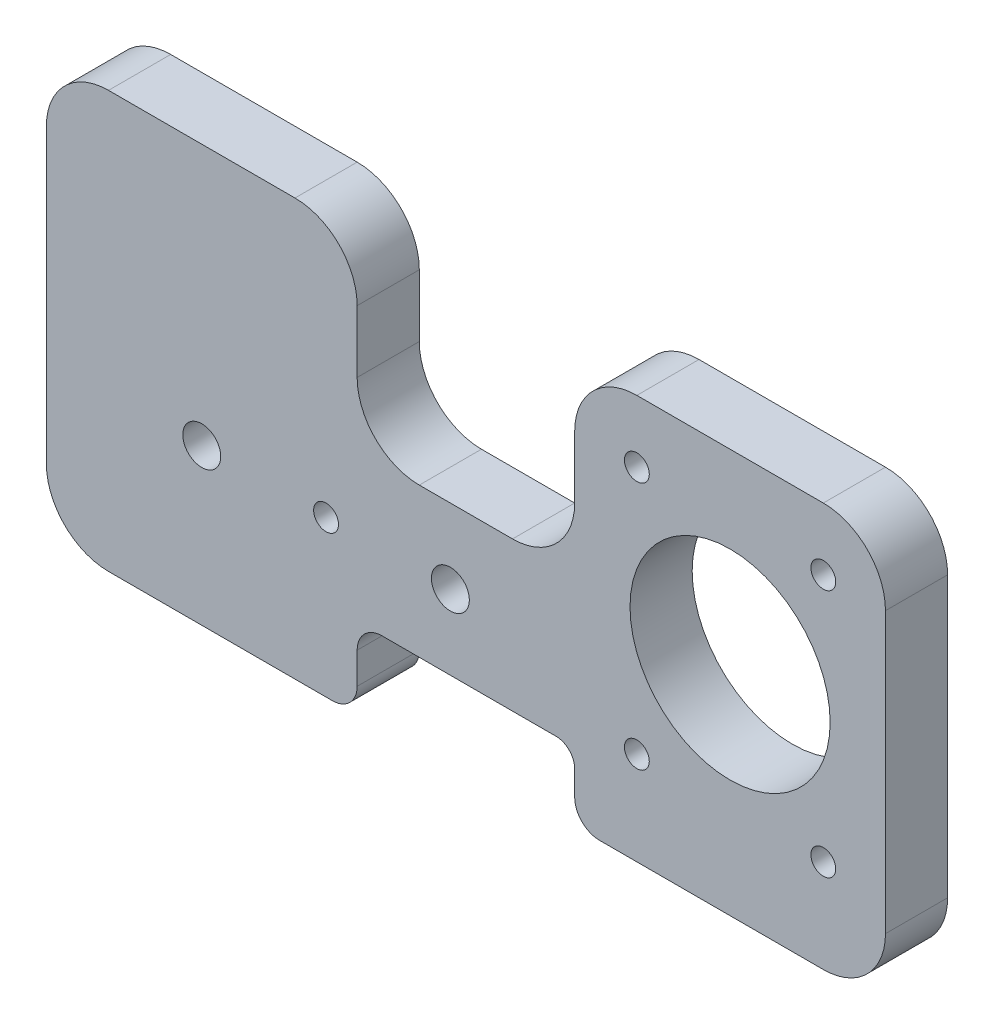
from build123d import *

# Parameters (mm, degrees)
MODEL_R             = 2
MODEL_R_2           = 3.05
MODEL_R_3           = 6.75
BOSS_EXTRUDE1_DEPTH = 10
SKETCH2_R           = 16.1
CUT_EXTRUDE1_DEPTH  = 10


with BuildPart() as part:
    # Model → Boss-Extrude1 (new body)
    with BuildSketch(Plane.XY):
        with BuildLine():
            Line((106.910569106, -1), (106.910569106, 3))
            ThreePointArc((106.910569106, 3), (106.031889449, 5.121320344), (103.910569106, 6))
            Line((103.910569106, 6), (75.910569106, 6))
            ThreePointArc((75.910569106, 6), (73.082141981, 4.828427125), (71.910569106, 2))
            Line((71.910569106, 2), (71.910569106, -3.03491552))
            ThreePointArc((71.910569106, -3.03491552), (70.73899623, -5.863342645), (67.910569106, -7.034915521))
            Line((67.910569106, -7.034915521), (31.910569106, -7.034915521))
            ThreePointArc((31.910569106, -7.034915521), (24.839501294, -4.105983332), (21.910569106, 2.96508448))
            Line((21.910569106, 2.96508448), (21.910569106, 50))
            ThreePointArc((21.910569106, 50), (24.839501294, 57.071067812), (31.910569106, 60))
            Line((31.910569106, 60), (61.910569106, 60))
            ThreePointArc((61.910569106, 60), (68.981636918, 57.071067812), (71.910569106, 50))
            Line((71.910569106, 50), (71.910569106, 40))
            ThreePointArc((71.910569106, 40), (74.839501294, 32.928932188), (81.910569106, 30))
            Line((81.910569106, 30), (96.910569106, 30))
            ThreePointArc((96.910569106, 30), (103.981636918, 32.928932188), (106.910569106, 40))
            Line((106.910569106, 40), (106.910569106, 50))
            ThreePointArc((106.910569106, 50), (109.839501294, 57.071067812), (116.910569106, 60))
            Line((116.910569106, 60), (146.910569106, 60))
            ThreePointArc((146.910569106, 60), (153.981636918, 57.071067812), (156.910569106, 50))
            Line((156.910569106, 50), (156.910569106, 5))
            ThreePointArc((156.910569106, 5), (153.981636918, -2.071067812), (146.910569106, -5))
            Line((146.910569106, -5), (110.910569106, -5))
            ThreePointArc((110.910569106, -5), (108.082141981, -3.828427125), (106.910569106, -1))
        make_face()
        with Locations((66.910569106, 18)):
            Circle(MODEL_R, mode=Mode.SUBTRACT)
        with Locations((46.910569106, 18)):
            Circle(MODEL_R_2, mode=Mode.SUBTRACT)
        with Locations((116.910569106, 10)):
            Circle(MODEL_R, mode=Mode.SUBTRACT)
        with Locations((146.910569106, 10)):
            Circle(MODEL_R, mode=Mode.SUBTRACT)
        with Locations((146.910569106, 50)):
            Circle(MODEL_R, mode=Mode.SUBTRACT)
        with Locations((116.910569106, 50)):
            Circle(MODEL_R, mode=Mode.SUBTRACT)
        with Locations((131.910569106, 30)):
            Circle(MODEL_R_3, mode=Mode.SUBTRACT)
        with Locations((86.910569106, 18)):
            Circle(MODEL_R_2, mode=Mode.SUBTRACT)
    extrude(amount=BOSS_EXTRUDE1_DEPTH)

    # Sketch2 → Cut-Extrude1 (cut)
    with BuildSketch(Plane.XY.offset(10)):
        with Locations((131.910569106, 30)):
            Circle(SKETCH2_R)
    extrude(amount=-CUT_EXTRUDE1_DEPTH, mode=Mode.SUBTRACT)


solid = part.part
